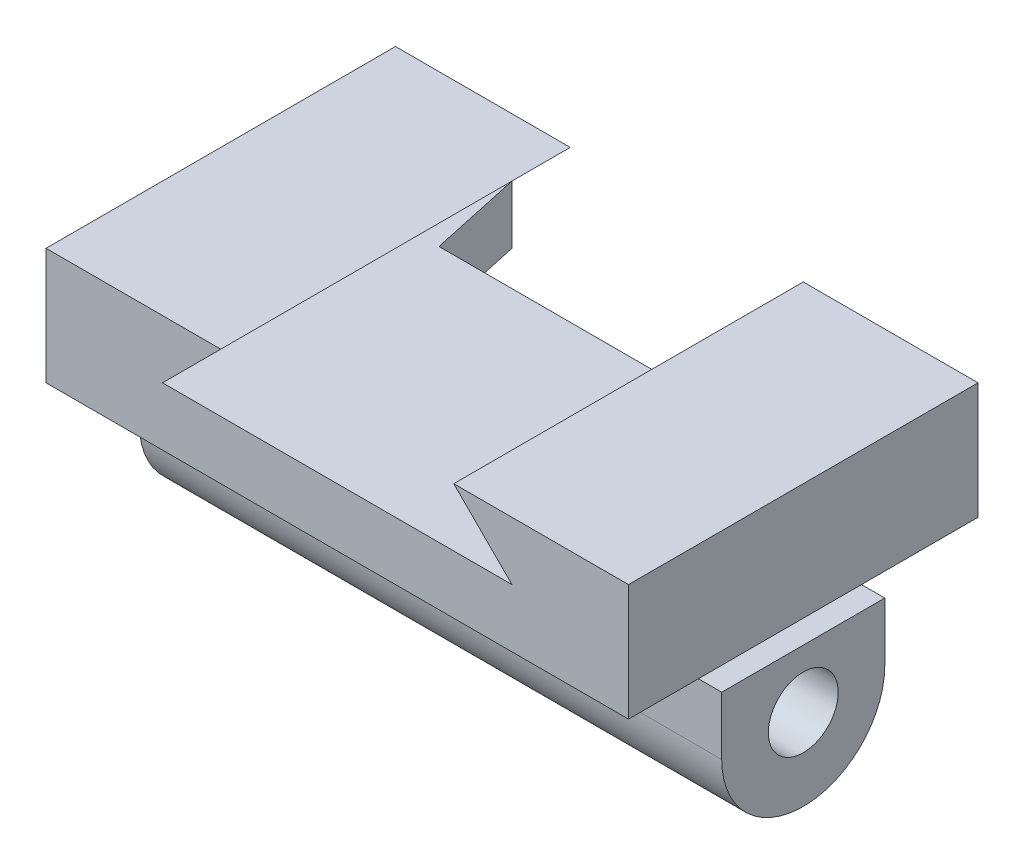
from build123d import *

# Parameters (mm, degrees)
BOSS_EXTRUDE1_DEPTH = 5
BOSS_EXTRUDE2_DEPTH = 2
BOSS_EXTRUDE7_DEPTH = 30
SKETCH11_R          = 3
BOSS_EXTRUDE8_DEPTH = 50


with BuildPart() as part:
    # Sketch1 → Boss-Extrude1 (new body)
    with BuildSketch(Plane(origin=(0, 0, 0), x_dir=(1, 0, 0), z_dir=(0, 1, 0))):
        Polygon((-15, 15), (-25, 15), (-25, -15), (25, -15), (25, 15), (15, 15), (13.266499161, 7), (-13.266499161, 7), align=None)
    extrude(amount=BOSS_EXTRUDE1_DEPTH)

    # Sketch4 → Boss-Extrude2 (add)
    with BuildSketch(Plane.XZ):
        with BuildLine():
            Line((13.266499161, 7), (-13.266499161, 7))
            ThreePointArc((-13.266499161, 7), (-15, 0), (-13.266499161, -7))
            Line((-13.266499161, -7), (13.266499161, -7))
            ThreePointArc((13.266499161, -7), (14.560176637, -3.605725487), (15, 0))
            ThreePointArc((15, 0), (14.560176637, 3.605725487), (13.266499161, 7))
        make_face()
    extrude(amount=BOSS_EXTRUDE2_DEPTH)

    # Sketch10 → Boss-Extrude7 (add)
    with BuildSketch(Plane.XY.offset(15)):
        Polygon((-10, 10), (-25, 10), (-25, 5), (-15, 5), align=None)
        Polygon((10, 10), (15, 5), (25, 5), (25, 10), align=None)
    extrude(amount=-BOSS_EXTRUDE7_DEPTH)

    # Sketch11 → Boss-Extrude8 (add)
    with BuildSketch(Plane(origin=(25, 0, 0), x_dir=(0, 0, -1), z_dir=(1, 0, 0))):
        with BuildLine():
            Line((-7, -7), (-7, -2))
            Line((-7, -2), (7, -2))
            Line((7, -2), (7, -7))
            ThreePointArc((7, -7), (0, -14), (-7, -7))
        make_face()
        with Locations((0, -7)):
            Circle(SKETCH11_R, mode=Mode.SUBTRACT)
    extrude(amount=-BOSS_EXTRUDE8_DEPTH)


solid = part.part
